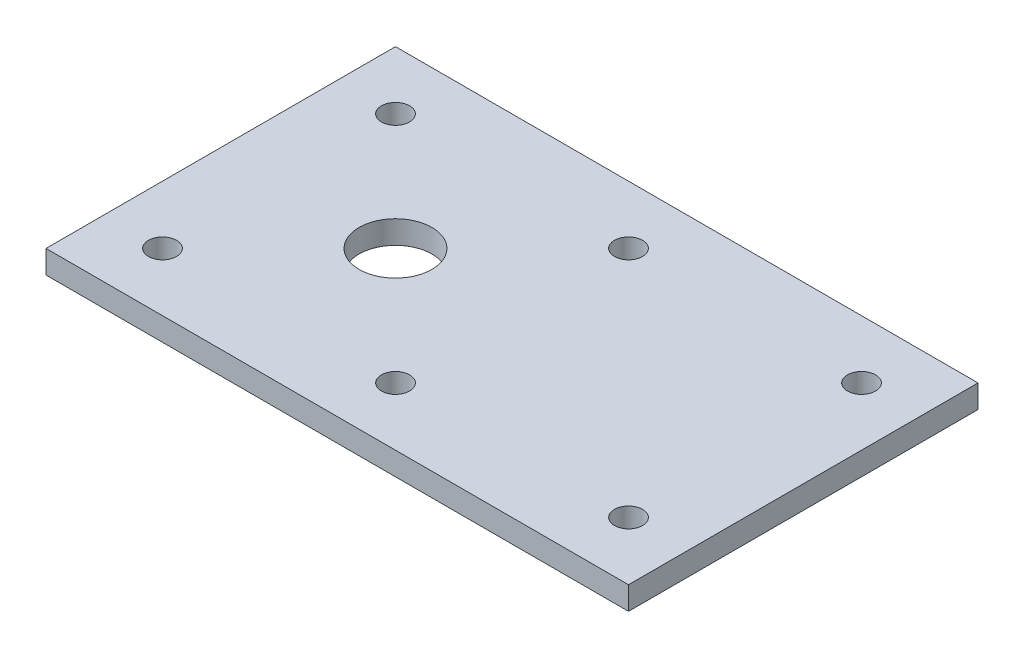
from build123d import *

# Parameters (mm, degrees)
SKETCH1_W            = 200
SKETCH1_H            = 120
BOSS_EXTRUDE1_DEPTH  = 7.9248
SKETCH3_R            = 4.826
CUT_EXTRUDE1_DEPTH   = 153.521481946
LPATTERN1_COUNT      = 3
LPATTERN1_PITCH      = 80
LPATTERN1_COUNT_DIR2 = 2
LPATTERN1_PITCH_DIR2 = 80
SKETCH6_R            = 12.5
CUT_EXTRUDE2_DEPTH   = 153.521481946


with BuildPart() as part:
    # Sketch1 → Boss-Extrude1 (new body)
    with BuildSketch(Plane(origin=(0, 0, 0), x_dir=(1, 0, 0), z_dir=(0, 1, 0))):
        with Locations((40, 0)):
            Rectangle(SKETCH1_W, SKETCH1_H)
    extrude(amount=BOSS_EXTRUDE1_DEPTH)

    # Sketch3 → Cut-Extrude1 (cut, through all)
    with BuildSketch(Plane(origin=(0, 7.9248, 0), x_dir=(1, 0, 0), z_dir=(0, 1, 0))):
        with Locations(Location((-40, 40, 0), (0, 0, 270))):
            Circle(SKETCH3_R)
    cut_extrude1 = extrude(amount=-CUT_EXTRUDE1_DEPTH, mode=Mode.SUBTRACT)

    # LPattern1: Cut-Extrude1 3 × 2
    with Locations(*[(i * LPATTERN1_PITCH, 0, j * LPATTERN1_PITCH_DIR2) for i in range(LPATTERN1_COUNT) for j in range(LPATTERN1_COUNT_DIR2) if (i, j) != (0, 0)]):
        add(cut_extrude1, mode=Mode.SUBTRACT)

    # Sketch6 → Cut-Extrude2 (cut, through all)
    with BuildSketch(Plane(origin=(0, 7.9248, 0), x_dir=(1, 0, 0), z_dir=(0, 1, 0))):
        with Locations(Location((0, 0, 0), (0, 0, 270))):
            Circle(SKETCH6_R)
    extrude(amount=-CUT_EXTRUDE2_DEPTH, mode=Mode.SUBTRACT)


solid = part.part
